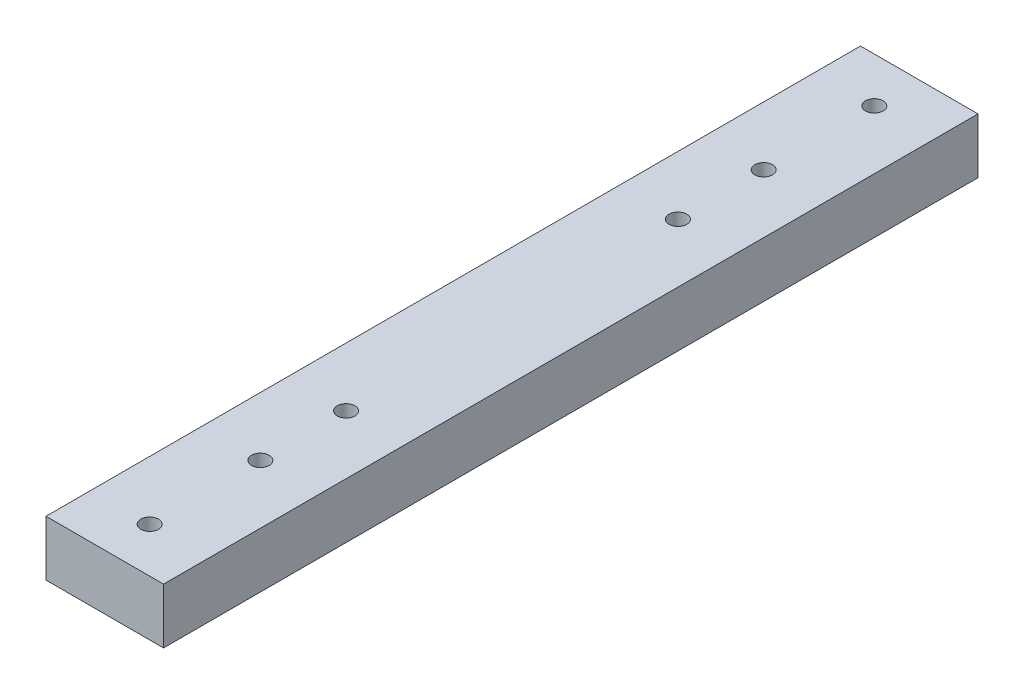
from build123d import *

# Parameters (mm, degrees)
SKETCH_1_W      = 15.25
SKETCH_1_H      = 141.25
SKETCH_1_R      = 1.6
EXTRUDE_1_DEPTH = 5
SKETCH_2_W      = 21.25
SKETCH_2_H      = 147.25
SKETCH_2_W_2    = 15.25
SKETCH_2_H_2    = 141.25
EXTRUDE_2_DEPTH = 10
CHAMFER_1_SIZE  = 2


with BuildPart() as part:
    # ｽｹｯﾁ1 → ﾎﾞｽ - 押し出し1 (new body)
    with BuildSketch(Plane(origin=(0, 5, 0), x_dir=(1, 0, 0), z_dir=(0, 1, 0))):
        Rectangle(SKETCH_1_W, SKETCH_1_H)
        with Locations(Location((0, -30, 0), (0, 0, 180))):
            Circle(SKETCH_1_R, mode=Mode.SUBTRACT)
        with Locations(Location((0, 65.5, 0), (0, 0, 180))):
            Circle(SKETCH_1_R, mode=Mode.SUBTRACT)
        with Locations(Location((0, 45.5, 0), (0, 0, 180))):
            Circle(SKETCH_1_R, mode=Mode.SUBTRACT)
        with Locations(Location((0, -45.5, 0), (0, 0, 180))):
            Circle(SKETCH_1_R, mode=Mode.SUBTRACT)
        with Locations(Location((0, 30, 0), (0, 0, 180))):
            Circle(SKETCH_1_R, mode=Mode.SUBTRACT)
        with Locations(Location((0, -65.5, 0), (0, 0, 180))):
            Circle(SKETCH_1_R, mode=Mode.SUBTRACT)
    extrude(amount=EXTRUDE_1_DEPTH)

    # ｽｹｯﾁ2 → ﾎﾞｽ - 押し出し2 (add)
    with BuildSketch(Plane(origin=(0, 10, 0), x_dir=(1, 0, 0), z_dir=(0, 1, 0))):
        Rectangle(SKETCH_2_W, SKETCH_2_H)
        Rectangle(SKETCH_2_W_2, SKETCH_2_H_2, mode=Mode.SUBTRACT)
    extrude(amount=-EXTRUDE_2_DEPTH)

    # 面取り1
    chamfer_1_edges = [part.edges().sort_by_distance(p)[0] for p in [
        (-7.625, 0, 0),
        (0, 0, 70.625),
        (7.625, 0, 0),
        (0, 0, -70.625),
    ]]
    chamfer(chamfer_1_edges, length=CHAMFER_1_SIZE)


solid = part.part
